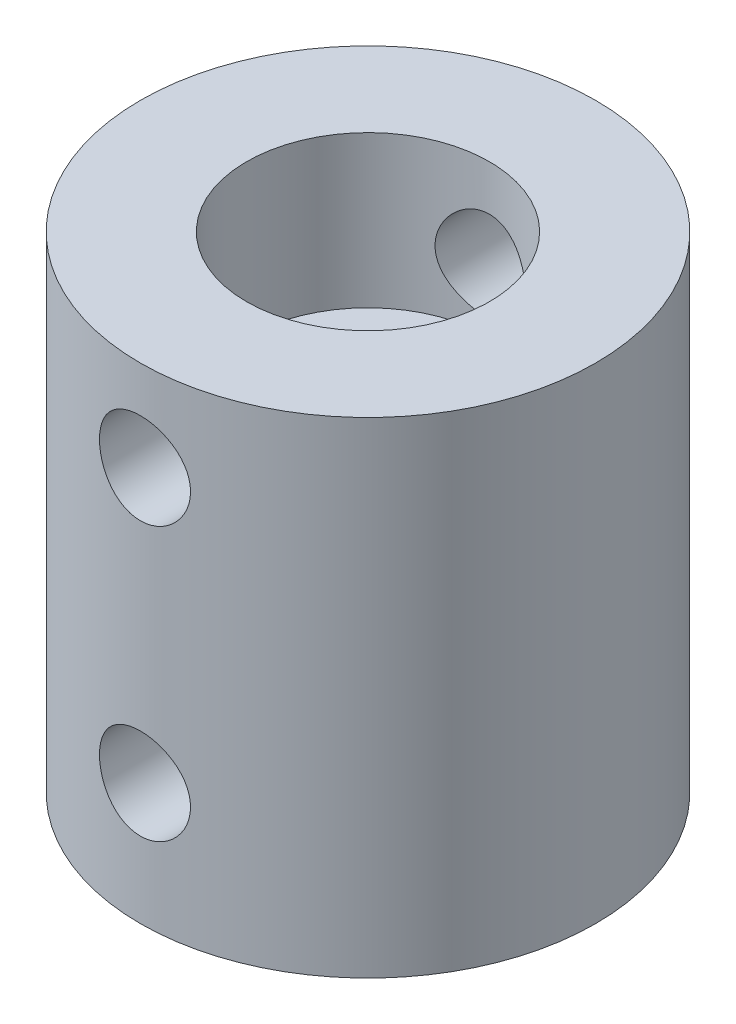
from build123d import *

# Parameters (mm, degrees)
SKETCH1_R               = 7.5
BOSS_EXTRUDE1_DEPTH     = 8
SKETCH2_R               = 4
CUT_EXTRUDE1_DEPTH      = 5
SKETCH3_R               = 2.5
CUT_EXTRUDE2_DEPTH      = 12
CUT_EXTRUDE3_DEPTH      = 14.285330256
CUT_EXTRUDE3_DEPTH_BACK = 14.285330256
SKETCH4_R               = 1.5


with BuildPart() as part:
    # Sketch1 → Boss-Extrude1 (new, symmetric)
    with BuildSketch(Plane(origin=(0, 0, 0), x_dir=(1, 0, 0), z_dir=(0, 1, 0))):
        with Locations(Location((0, 0, 0), (0, 0, 270))):
            Circle(SKETCH1_R)
    extrude(amount=BOSS_EXTRUDE1_DEPTH, both=True)

    # Sketch2 → Cut-Extrude1 (cut)
    with BuildSketch(Plane(origin=(0, 8, 0), x_dir=(1, 0, 0), z_dir=(0, 1, 0))):
        with Locations(Location((0, 0, 0), (0, 0, 270))):
            Circle(SKETCH2_R)
    extrude(amount=-CUT_EXTRUDE1_DEPTH, mode=Mode.SUBTRACT)

    # Sketch3 → Cut-Extrude2 (cut)
    with BuildSketch(Plane.XZ.offset(8)):
        with Locations(Location((0, 0, 0), (0, 0, 270))):
            Circle(SKETCH3_R)
    extrude(amount=-CUT_EXTRUDE2_DEPTH, mode=Mode.SUBTRACT)

    # Sketch4 → Cut-Extrude3 (cut, two sides: drawn at the far end of the back side and taken through both)
    with BuildSketch(Plane.XY.offset(-CUT_EXTRUDE3_DEPTH_BACK)):
        with Locations((0, -4)):
            Circle(SKETCH4_R)
        with Locations((0, 5)):
            Circle(SKETCH4_R)
    extrude(amount=CUT_EXTRUDE3_DEPTH + CUT_EXTRUDE3_DEPTH_BACK, mode=Mode.SUBTRACT)


solid = part.part
